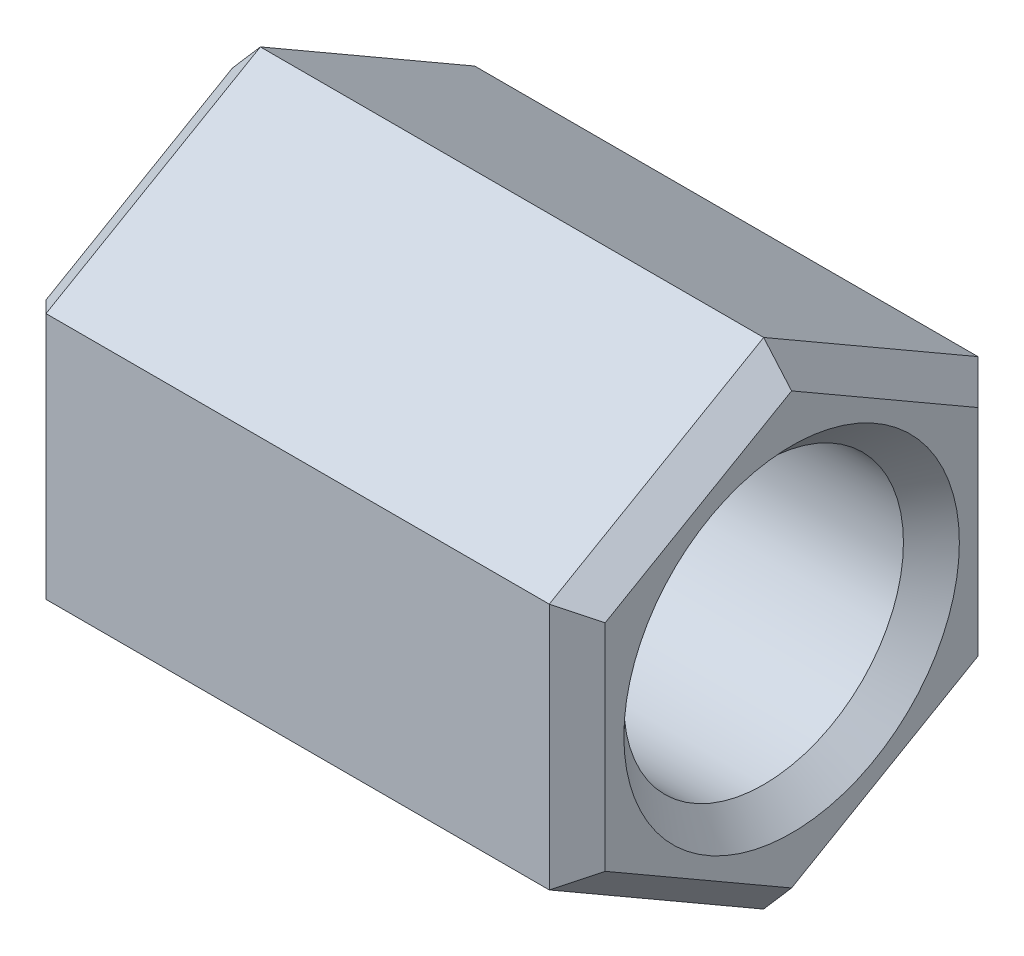
from build123d import *

# Parameters (mm, degrees)
SKETCH_1_R      = 1.5
EXTRUDE_1_DEPTH = 6
CHAMFER_1_SIZE  = 0.3


with BuildPart() as part:
    # 草图1 → 凸台-拉伸1 (new body)
    with BuildSketch(Plane.YZ):
        Polygon((2.655811238, 0), (1.327905619, 2.3), (-1.327905619, 2.3), (-2.655811238, 0), (-1.327905619, -2.3), (1.327905619, -2.3), align=None)
        with Locations(Location((0, 0, 0), (0, 0, 270))):
            Circle(SKETCH_1_R, mode=Mode.SUBTRACT)
    extrude(amount=EXTRUDE_1_DEPTH)

    # 倒角1
    chamfer_1_edges = [part.edges().sort_by_distance(p)[0] for p in [
        (6, 0, 2.3),
        (6, -1.991858429, 1.15),
        (0, 0, 1.5),
        (6, 0, 1.5),
        (6, -1.991858429, -1.15),
        (6, 0, -2.3),
        (6, 1.991858429, -1.15),
        (0, 0, -2.3),
        (0, -1.991858429, -1.15),
        (0, -1.991858429, 1.15),
        (0, 0, 2.3),
        (0, 1.991858429, 1.15),
        (0, 1.991858429, -1.15),
        (6, 1.991858429, 1.15),
    ]]
    chamfer(chamfer_1_edges, length=CHAMFER_1_SIZE)


solid = part.part
